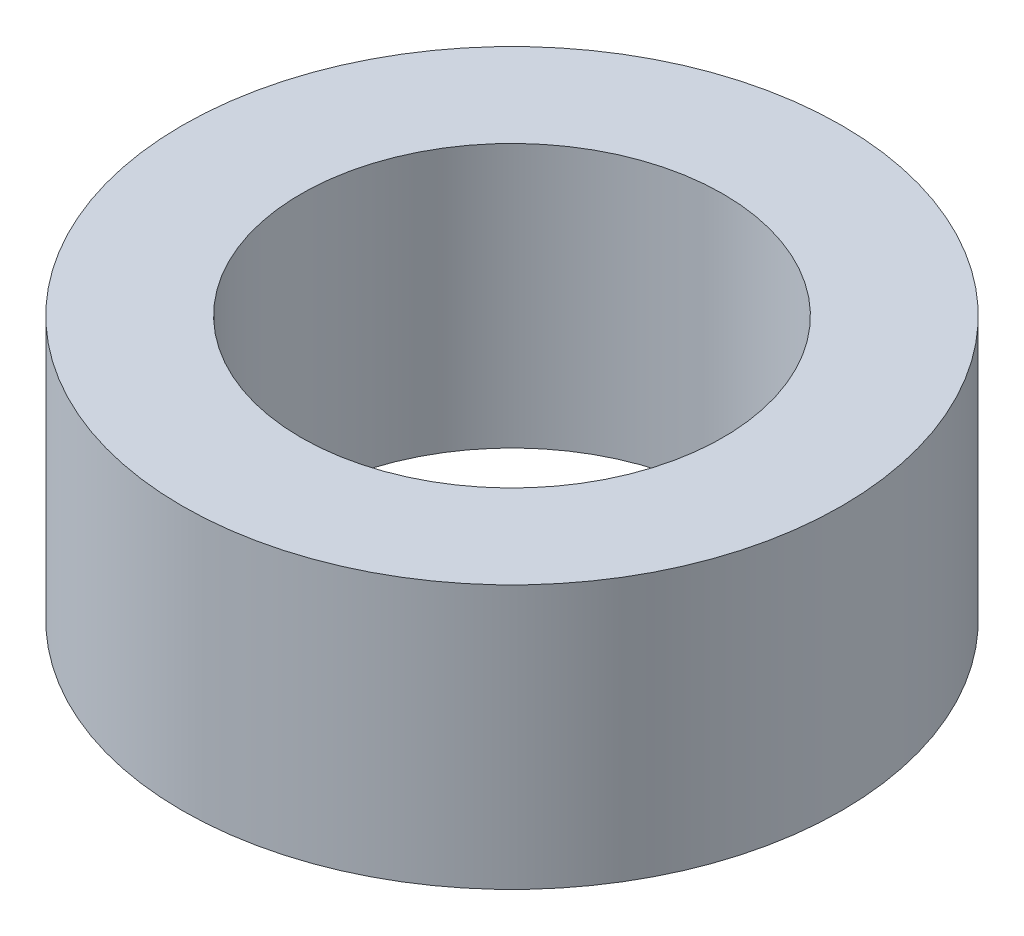
from build123d import *

# Parameters (mm, degrees)
SKETCH1_R           = 25
BOSS_EXTRUDE1_DEPTH = 20
SKETCH2_R           = 16
CUT_EXTRUDE1_DEPTH  = 41.620192023


with BuildPart() as part:
    # Sketch1 → Boss-Extrude1 (new body)
    with BuildSketch(Plane(origin=(0, 0, 0), x_dir=(1, 0, 0), z_dir=(0, 1, 0))):
        with Locations(Location((0, 0, 0), (0, 0, 270))):
            Circle(SKETCH1_R)
    extrude(amount=BOSS_EXTRUDE1_DEPTH)

    # Sketch2 → Cut-Extrude1 (cut, through all)
    with BuildSketch(Plane(origin=(0, 20, 0), x_dir=(1, 0, 0), z_dir=(0, 1, 0))):
        with Locations(Location((0, 0, 0), (0, 0, 270))):
            Circle(SKETCH2_R)
    extrude(amount=-CUT_EXTRUDE1_DEPTH, mode=Mode.SUBTRACT)


solid = part.part
